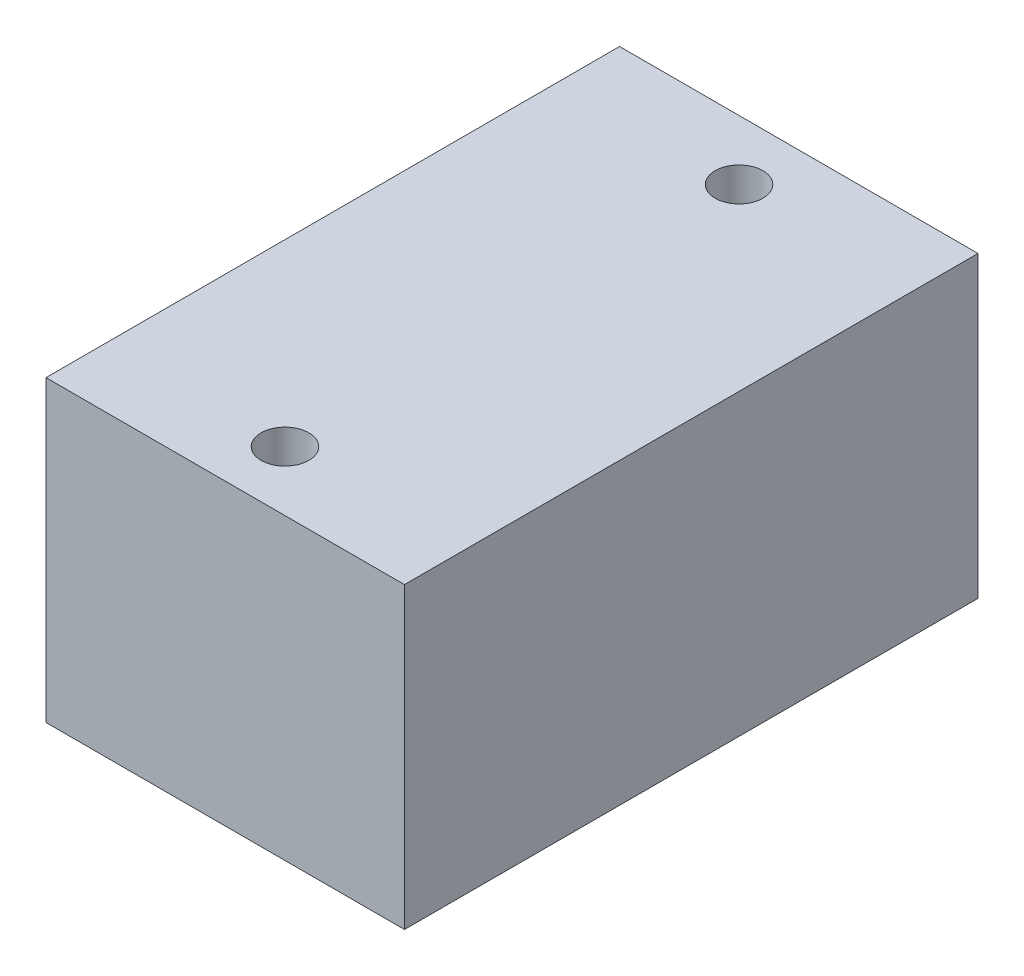
from build123d import *

# Parameters (mm, degrees)
SKETCH1_W           = 30
SKETCH1_H           = 25
BOSS_EXTRUDE1_DEPTH = 48
SKETCH2_R           = 2
CUT_EXTRUDE3_DEPTH  = 10
SKETCH3_R           = 2
CUT_EXTRUDE4_DEPTH  = 10


with BuildPart() as part:
    # Sketch1 → Boss-Extrude1 (new body)
    with BuildSketch(Plane.XY):
        with Locations((15, 12.5)):
            Rectangle(SKETCH1_W, SKETCH1_H)
    extrude(amount=BOSS_EXTRUDE1_DEPTH)

    # Sketch2 → Cut-Extrude3 (cut)
    with BuildSketch(Plane(origin=(0, 25, 0), x_dir=(1, 0, 0), z_dir=(0, 1, 0))):
        with Locations(Location((15, -5, 0), (0, 0, 180))):
            Circle(SKETCH2_R)
        with Locations(Location((15, -43, 0), (0, 0, 180))):
            Circle(SKETCH2_R)
    extrude(amount=-CUT_EXTRUDE3_DEPTH, mode=Mode.SUBTRACT)

    # Sketch3 → Cut-Extrude4 (cut)
    with BuildSketch(Plane.XZ):
        with Locations(Location((15, 39, 0), (0, 0, 270))):
            Circle(SKETCH3_R)
        with Locations(Location((15, 9, 0), (0, 0, 270))):
            Circle(SKETCH3_R)
    extrude(amount=-CUT_EXTRUDE4_DEPTH, mode=Mode.SUBTRACT)


solid = part.part
